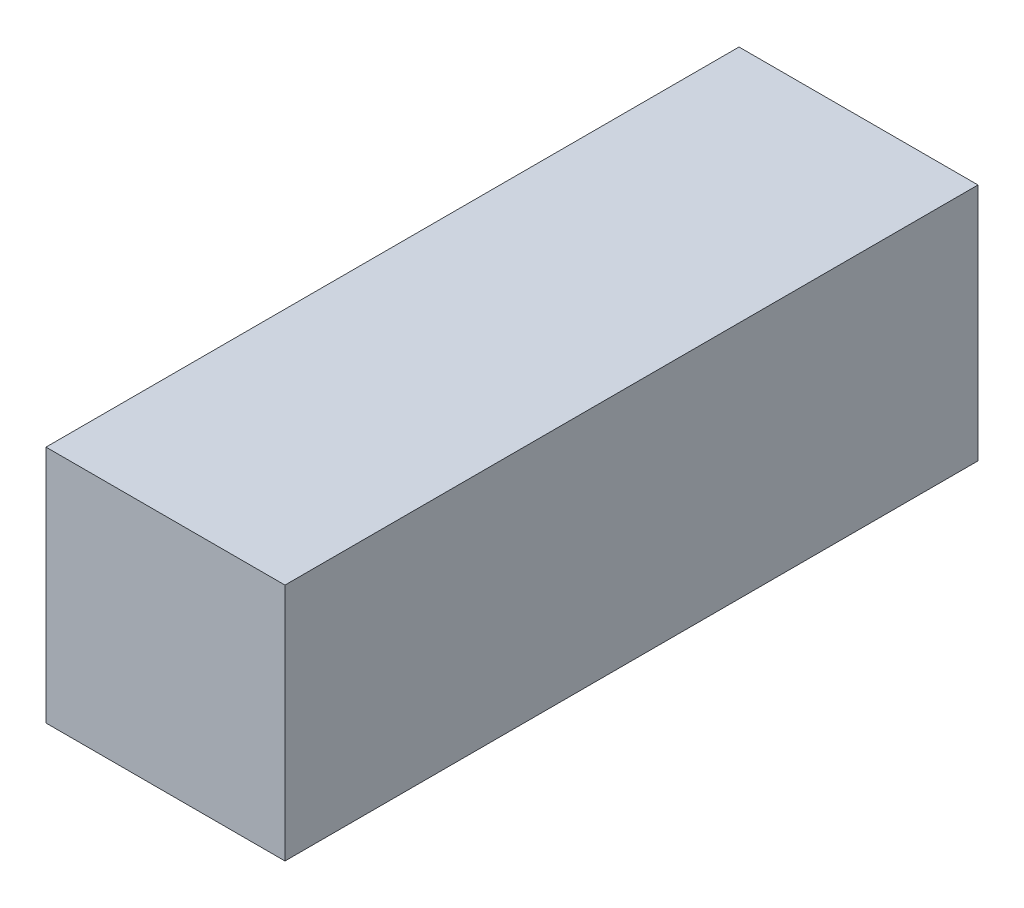
from build123d import *

# Parameters (mm, degrees)
SKETCH_1_W                = 20
SKETCH_1_H                = 20
V2_REF_GRIPPER_BODY_DEPTH = 58


with BuildPart() as part:
    # 草图1 → V2_REF_gripper_body (new body)
    with BuildSketch(Plane.XY):
        with Locations((10, 10)):
            Rectangle(SKETCH_1_W, SKETCH_1_H)
    extrude(amount=V2_REF_GRIPPER_BODY_DEPTH)


solid = part.part
